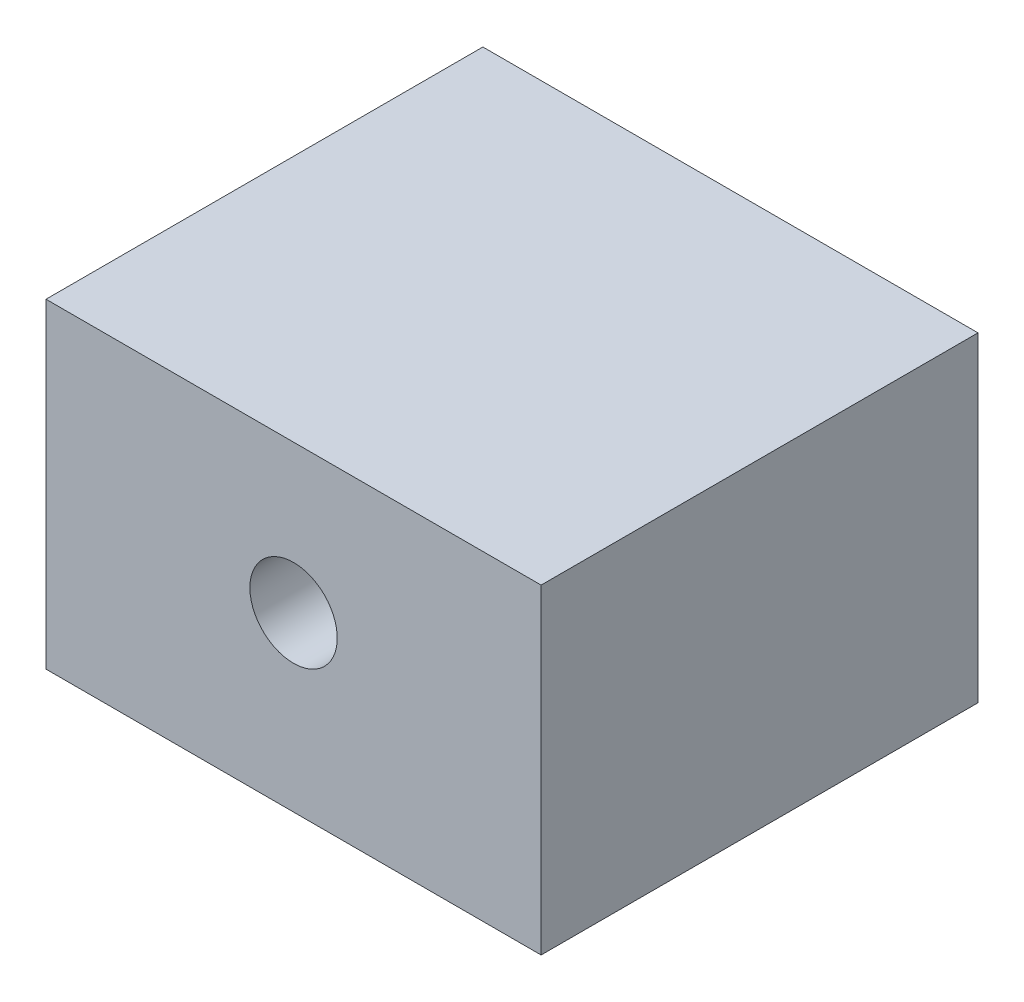
from build123d import *

# Parameters (mm, degrees)
SKETCH_1_W          = 34
SKETCH_1_H          = 30
EXTRUDE_1_DEPTH     = 22
SKETCH_2_R          = 3
CUT_EXTRUDE_1_DEPTH = 42.773197148
SKETCH_3_R          = 2.1
CUT_EXTRUDE_2_DEPTH = 10


with BuildPart() as part:
    # 草图1 → 凸台-拉伸1 (new body)
    with BuildSketch(Plane(origin=(0, 0, 0), x_dir=(1, 0, 0), z_dir=(0, 1, 0))):
        Rectangle(SKETCH_1_W, SKETCH_1_H)
    extrude(amount=EXTRUDE_1_DEPTH)

    # 草图2 → 切除-拉伸1 (cut, through all)
    with BuildSketch(Plane(origin=(2, 0, 15), x_dir=(-1, 0, 0), z_dir=(0, 0, -1))):
        with Locations((2, 11.846291658)):
            Circle(SKETCH_2_R)
    extrude(amount=CUT_EXTRUDE_1_DEPTH, mode=Mode.SUBTRACT)

    # 草图3 → 切除-拉伸2 (cut)
    with BuildSketch(Plane.XZ):
        with Locations(Location((12, 9, 0), (0, 0, 270))):
            Circle(SKETCH_3_R)
        with Locations(Location((12, -9, 0), (0, 0, 270))):
            Circle(SKETCH_3_R)
        with Locations(Location((-12, 9, 0), (0, 0, 270))):
            Circle(SKETCH_3_R)
        with Locations(Location((-12, -9, 0), (0, 0, 270))):
            Circle(SKETCH_3_R)
    extrude(amount=-CUT_EXTRUDE_2_DEPTH, mode=Mode.SUBTRACT)


solid = part.part
